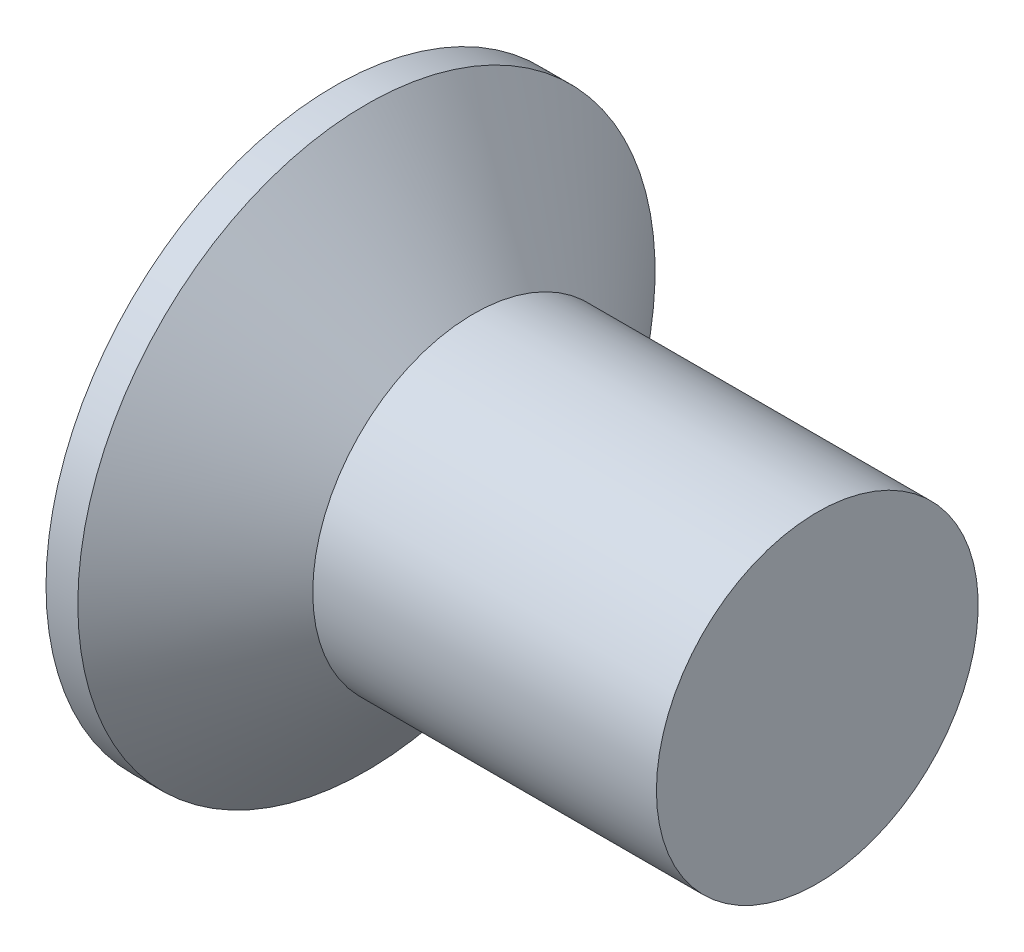
from build123d import *

# Parameters (mm, degrees)
CIRPATTERN1_COUNT = 2
CIRPATTERN1_ANGLE = 90


with BuildPart() as part:
    # BodySke → Base-Revolve (revolve)
    with BuildSketch(Plane.XY, mode=Mode.PRIVATE) as base_revolve_sk:
        Polygon((0, 0), (0, 11.3919), (1.25574357, 11.3919), (5.4864, 6.35), (19.05, 6.35), (19.05, 0), align=None)
    revolve(base_revolve_sk.sketch.rotate(Axis((-6.35, 0, 0), (1, 0, 0)), 90), axis=Axis((-6.35, 0, 0), (1, 0, 0)))

    # Sketch3 → Cross section 0
    with BuildSketch(Plane.ZY):
        with BuildLine():
            Line((-1.1811, 7.1501), (1.1811, 7.1501))
            Line((1.1811, 7.1501), (1.1811, -7.1501))
            Line((1.1811, -7.1501), (-1.1811, -7.1501))
            Line((-1.1811, -7.1501), (-1.1811, 7.1501))
        make_face()
    # Sketch4 → Cross section 1
    with BuildSketch(Plane.ZY.offset(-9.3218)):
        with BuildLine():
            Line((-0.59055, 0.59055), (0.59055, 0.59055))
            Line((0.59055, 0.59055), (0.59055, -0.59055))
            Line((0.59055, -0.59055), (-0.59055, -0.59055))
            Line((-0.59055, -0.59055), (-0.59055, 0.59055))
        make_face()
    cross = loft(mode=Mode.SUBTRACT)

    # CirPattern1: Cross ×2 about axis
    cirpattern1_axis = Axis((0, 0, 0), (1, 0, 0))
    for i in range(1, CIRPATTERN1_COUNT):
        add(cross.rotate(cirpattern1_axis, i * CIRPATTERN1_ANGLE / (CIRPATTERN1_COUNT - 1)), mode=Mode.SUBTRACT)


solid = part.part
